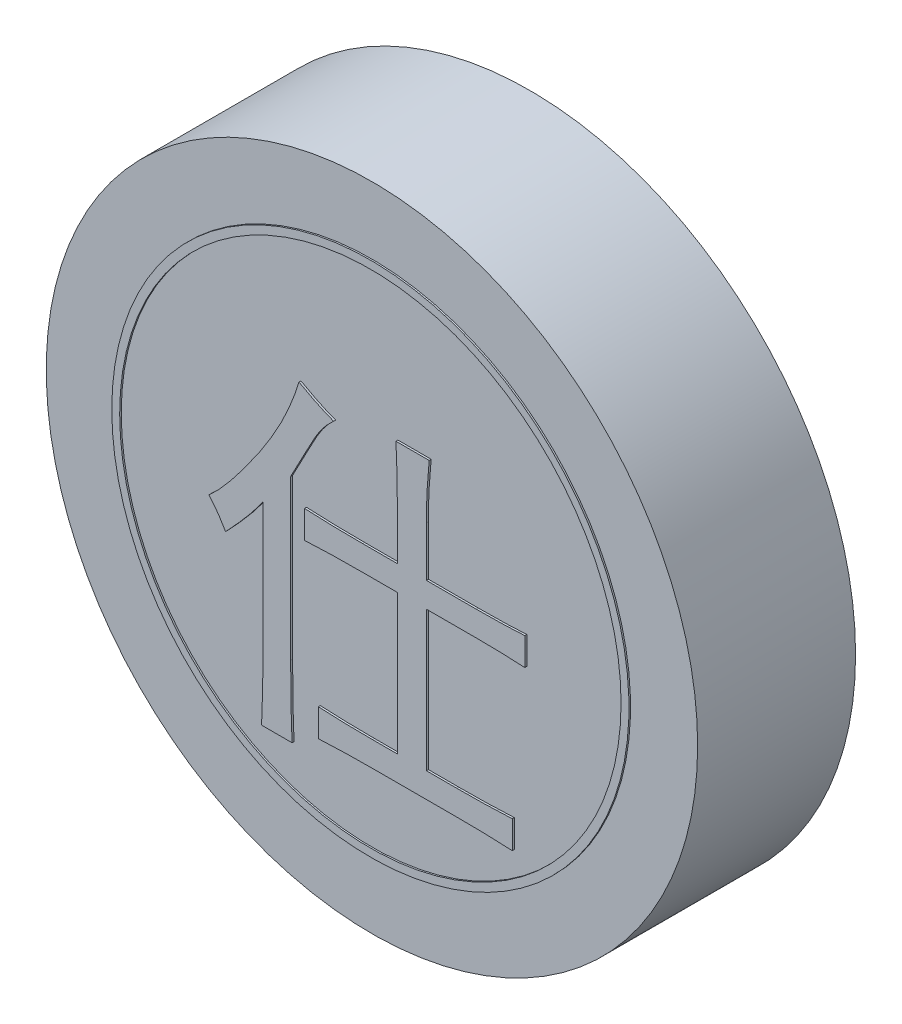
from build123d import *

# Parameters (mm, degrees)
SKETCH_1_R               = 16.5
DIAMETER33_HEIGHT8_DEPTH = 8
CHARACTER_DEPTH          = 0.1
SKETCH_3_R               = 13.1
SKETCH_3_R_2             = 12.7
INK_RING_DEPTH           = 0.08


with BuildPart() as part:
    # 草图1 → Diameter33_Height8 (new body)
    with BuildSketch(Plane.XY):
        Circle(SKETCH_1_R)
    extrude(amount=-DIAMETER33_HEIGHT8_DEPTH)

    # 草图2 → Character_仕 (add)
    with BuildSketch(Plane.XY):
        with BuildLine():
            Line((1.385964912, 0.48245614), (1.385964912, 3.078947368))
            add(Edge.make_bspline(
                [(1.385964912, 3.078947368), (1.382856556, 3.540795331), (1.376713677, 4.453520939), (1.335934161, 5.365353156), (1.315789474, 5.815789474)],
                knots=[0, 0, 0, 0, 1.012019295, 2, 2, 2, 2], degree=3))
            Line((1.315789474, 5.815789474), (3, 5.815789474))
            add(Edge.make_bspline(
                [(3, 5.815789474), (2.977495606, 5.590667791), (2.932023515, 5.135789802), (2.894778649, 4.442009997), (2.862268379, 3.73162247), (2.860528273, 3.251395934), (2.859649123, 3.00877193)],
                knots=[0, 0, 0, 0, 0.965427312, 1.950730062, 2.964650972, 4, 4, 4, 4], degree=3))
            Line((2.859649123, 3.00877193), (2.859649123, 0.48245614))
            Line((2.859649123, 0.48245614), (5.385964912, 0.48245614))
            add(Edge.make_bspline(
                [(5.385964912, 0.48245614), (5.612960978, 0.48353494), (6.051396179, 0.485618604), (6.68734214, 0.499259504), (7.279297852, 0.517890937), (7.659345282, 0.541350279), (7.842105263, 0.552631579)],
                knots=[0, 0, 0, 0, 1.108393509, 2.14082447, 3.105946107, 4, 4, 4, 4], degree=3))
            Line((7.842105263, 0.552631579), (7.842105263, -0.850877193))
            add(Edge.make_bspline(
                [(7.842105263, -0.850877193), (7.659345282, -0.839595893), (7.279297852, -0.816136551), (6.68734214, -0.797505118), (6.051396179, -0.783864218), (5.612960978, -0.781780554), (5.385964912, -0.780701754)],
                knots=[0, 0, 0, 0, 0.894053893, 1.85917553, 2.891606491, 4, 4, 4, 4], degree=3))
            Line((5.385964912, -0.780701754), (2.859649123, -0.780701754))
            Line((2.859649123, -0.780701754), (2.859649123, -7.868421053))
            Line((2.859649123, -7.868421053), (4.403508772, -7.868421053))
            add(Edge.make_bspline(
                [(4.403508772, -7.868421053), (4.663425226, -7.867326084), (5.166829886, -7.865205357), (5.894610336, -7.851761208), (6.570572064, -7.832958173), (7.00263653, -7.809522024), (7.210526316, -7.798245614)],
                knots=[0, 0, 0, 0, 1.110647855, 2.151096232, 3.11039153, 4, 4, 4, 4], degree=3))
            Line((7.210526316, -7.798245614), (7.210526316, -9.201754386))
            add(Edge.make_bspline(
                [(7.210526316, -9.201754386), (7.010437031, -9.190419998), (6.583606619, -9.166241483), (5.90326924, -9.148137401), (5.144305253, -9.134624919), (4.612310457, -9.132626772), (4.333333333, -9.131578947)],
                knots=[0, 0, 0, 0, 0.835449614, 1.782180905, 2.836979614, 4, 4, 4, 4], degree=3))
            Line((4.333333333, -9.131578947), (0.263157895, -9.131578947))
            add(Edge.make_bspline(
                [(0.263157895, -9.131578947), (-0.015819229, -9.132626772), (-0.547814025, -9.134624919), (-1.306778012, -9.148137401), (-1.987115391, -9.166241483), (-2.413945803, -9.190419998), (-2.614035088, -9.201754386)],
                knots=[0, 0, 0, 0, 1.163020386, 2.217819095, 3.164550386, 4, 4, 4, 4], degree=3))
            Line((-2.614035088, -9.201754386), (-2.614035088, -7.798245614))
            add(Edge.make_bspline(
                [(-2.614035088, -7.798245614), (-2.407878143, -7.809517208), (-1.981010451, -7.832856124), (-1.318910587, -7.851574268), (-0.61279286, -7.865227274), (-0.127579839, -7.86733394), (0.122807018, -7.868421053)],
                knots=[0, 0, 0, 0, 0.904818853, 1.873514066, 2.902659025, 4, 4, 4, 4], degree=3))
            Line((0.122807018, -7.868421053), (1.385964912, -7.868421053))
            Line((1.385964912, -7.868421053), (1.385964912, -0.780701754))
            Line((1.385964912, -0.780701754), (-0.298245614, -0.780701754))
            add(Edge.make_bspline(
                [(-0.298245614, -0.780701754), (-0.452461393, -0.780188061), (-0.752239456, -0.7791895), (-1.189731892, -0.786231443), (-1.603011279, -0.790357704), (-1.992035716, -0.797879868), (-2.356713286, -0.809539056), (-2.697351984, -0.817728412), (-3.014316789, -0.834938878), (-3.217890625, -0.845701458), (-3.315789474, -0.850877193)],
                knots=[0, 0, 0, 0, 1.226022714, 2.383249742, 3.478491498, 4.511863319, 5.476544353, 6.379262498, 7.220585815, 8, 8, 8, 8], degree=3))
            Line((-3.315789474, -0.850877193), (-3.315789474, 0.552631579))
            add(Edge.make_bspline(
                [(-3.315789474, 0.552631579), (-3.21875707, 0.547453703), (-3.016916501, 0.536683017), (-2.703415706, 0.519544836), (-2.367110401, 0.511265445), (-2.010227251, 0.49975938), (-1.630736813, 0.492055864), (-1.229584063, 0.488016267), (-0.805954579, 0.480955843), (-0.51657237, 0.481948131), (-0.368421053, 0.48245614)],
                knots=[0, 0, 0, 0, 0.790917863, 1.645216496, 2.555317213, 3.528854326, 4.55156314, 5.644660669, 6.794166974, 8, 8, 8, 8], degree=3))
            Line((-0.368421053, 0.48245614), (1.385964912, 0.48245614))
        make_face()
        with BuildLine():
            add(Edge.make_bspline(
                [(-1.842105263, 5.114035088), (-1.933851435, 5.029026304), (-2.117541902, 4.858825164), (-2.365563333, 4.57167672), (-2.591993254, 4.259206087), (-2.763277727, 3.974023896), (-2.899956693, 3.72227062), (-3.016573333, 3.503293196), (-3.149738899, 3.257168631), (-3.294556387, 2.980814576), (-3.455706316, 2.678049907), (-3.630506142, 2.346123327), (-3.820034881, 1.98606085), (-3.950103328, 1.735288634), (-4.01754386, 1.605263158)],
                knots=[0, 0, 0, 0, 1.083759172, 2.169858686, 3.283228111, 4.425909641, 5.051182283, 5.766997595, 6.57693099, 7.477449721, 8.472081343, 9.550673888, 10.730023607, 12, 12, 12, 12], degree=3))
            Line((-4.01754386, 1.605263158), (-4.01754386, -6.464912281))
            add(Edge.make_bspline(
                [(-4.01754386, -6.464912281), (-4.018056133, -6.65204931), (-4.019052245, -7.015935362), (-4.012047973, -7.545266441), (-4.007901436, -8.042578811), (-4.000400634, -8.506973521), (-3.988771218, -8.938370958), (-3.98063319, -9.336170915), (-3.963429216, -9.700804491), (-3.952560119, -9.932966081), (-3.947368421, -10.043859649)],
                knots=[0, 0, 0, 0, 1.25452393, 2.439409025, 3.548794241, 4.588568869, 5.552973603, 6.441898353, 7.255762113, 8, 8, 8, 8], degree=3))
            Line((-3.947368421, -10.043859649), (-5.49122807, -10.043859649))
            add(Edge.make_bspline(
                [(-5.49122807, -10.043859649), (-5.48604403, -9.933832078), (-5.4752279, -9.704267368), (-5.458045854, -9.34570061), (-5.449866698, -8.958296312), (-5.43824574, -8.54249494), (-5.430714946, -8.098893278), (-5.426551478, -7.626704474), (-5.419547466, -7.12596442), (-5.420541736, -6.782003967), (-5.421052632, -6.605263158)],
                knots=[0, 0, 0, 0, 0.768562205, 1.603550436, 2.504569286, 3.472060047, 4.505901887, 5.600100741, 6.766834584, 8, 8, 8, 8], degree=3))
            Line((-5.421052632, -6.605263158), (-5.421052632, -0.219298246))
            add(Edge.make_bspline(
                [(-5.421052632, -0.219298246), (-5.477100123, -0.297465115), (-5.593729665, -0.460122996), (-5.780061764, -0.708596832), (-5.986068105, -0.970387502), (-6.216160665, -1.241667605), (-6.462173545, -1.53007964), (-6.726721569, -1.832063458), (-7.014400911, -2.14414193), (-7.213381091, -2.355918188), (-7.315789474, -2.464912281)],
                knots=[0, 0, 0, 0, 0.784966074, 1.633440328, 2.534521274, 3.503196048, 4.536232569, 5.628408604, 6.779421952, 8, 8, 8, 8], degree=3))
            add(Edge.make_bspline(
                [(-7.315789474, -2.464912281), (-7.376217454, -2.360289355), (-7.496986321, -2.151194296), (-7.698613752, -1.847907954), (-7.919509238, -1.554794995), (-8.078179419, -1.366518997), (-8.157894737, -1.271929825)],
                knots=[0, 0, 0, 0, 0.990939877, 1.980451519, 2.985386235, 4, 4, 4, 4], degree=3))
            add(Edge.make_bspline(
                [(-8.157894737, -1.271929825), (-8.078444276, -1.200683827), (-7.908680075, -1.048450351), (-7.650883543, -0.790792829), (-7.380450508, -0.484210357), (-7.085685528, -0.139123391), (-6.774453616, 0.251552056), (-6.444928694, 0.686800589), (-6.093822829, 1.163741111), (-5.733795482, 1.678782143), (-5.373823069, 2.211324676), (-5.038729415, 2.753088359), (-4.729340369, 3.291388528), (-4.443634689, 3.826106433), (-4.193529603, 4.362171988), (-3.965829486, 4.893831939), (-3.764036827, 5.42296806), (-3.651942432, 5.779680656), (-3.596491228, 5.956140351)],
                knots=[0, 0, 0, 0, 0.593635041, 1.268437926, 2.026139621, 2.86729733, 3.793145817, 4.804357063, 5.904290477, 7.087660503, 8.300109294, 9.479773153, 10.630579527, 11.753876596, 12.851315059, 13.920229824, 14.971172829, 16, 16, 16, 16], degree=3))
            add(Edge.make_bspline(
                [(-3.596491228, 5.956140351), (-3.455102142, 5.876001082), (-3.172790986, 5.715987251), (-2.737023645, 5.499372043), (-2.295481279, 5.293961951), (-1.99346903, 5.174105332), (-1.842105263, 5.114035088)],
                knots=[0, 0, 0, 0, 1.001016569, 1.998726716, 2.996993449, 4, 4, 4, 4], degree=3))
        make_face()
    extrude(amount=CHARACTER_DEPTH)

    # 草图3 → Ink_ring (add)
    with BuildSketch(Plane.XY):
        with Locations(Location((0, 0, 0), (0, 0, 180))):
            Circle(SKETCH_3_R)
        with Locations(Location((0, 0, 0), (0, 0, 180))):
            Circle(SKETCH_3_R_2, mode=Mode.SUBTRACT)
    extrude(amount=INK_RING_DEPTH)


solid = part.part
